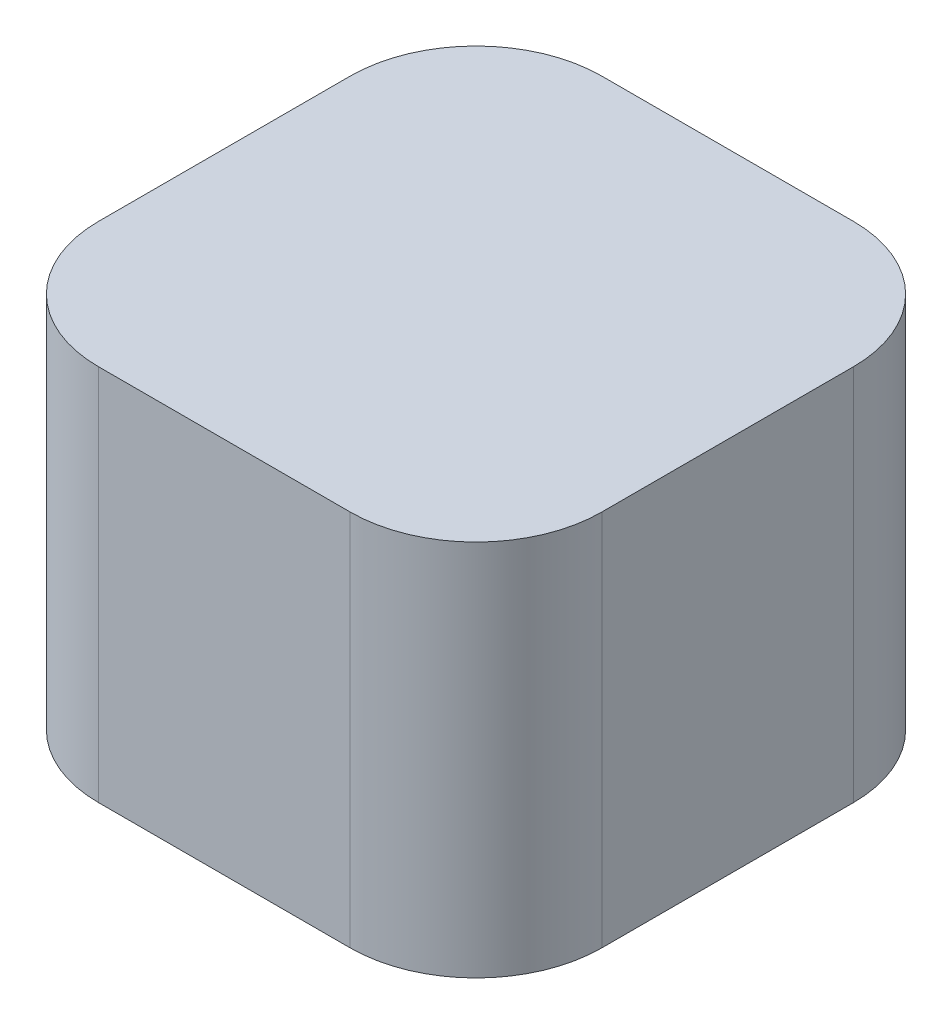
from build123d import *

# Parameters (mm, degrees)
BOSS_EXTRUDE1_DEPTH = 30


with BuildPart() as part:
    # Sketch1 → Boss-Extrude1 (new body)
    with BuildSketch(Plane(origin=(0, 0, 0), x_dir=(1, 0, 0), z_dir=(0, 1, 0))):
        with BuildLine():
            Line((10, 0), (30, 0))
            ThreePointArc((30, 0), (37.071067812, 2.928932188), (40, 10))
            Line((40, 10), (40, 30))
            ThreePointArc((40, 30), (37.071067812, 37.071067812), (30, 40))
            Line((30, 40), (10, 40))
            ThreePointArc((10, 40), (2.928932188, 37.071067812), (0, 30))
            Line((0, 30), (0, 10))
            ThreePointArc((0, 10), (2.928932188, 2.928932188), (10, 0))
        make_face()
    extrude(amount=BOSS_EXTRUDE1_DEPTH)


solid = part.part
